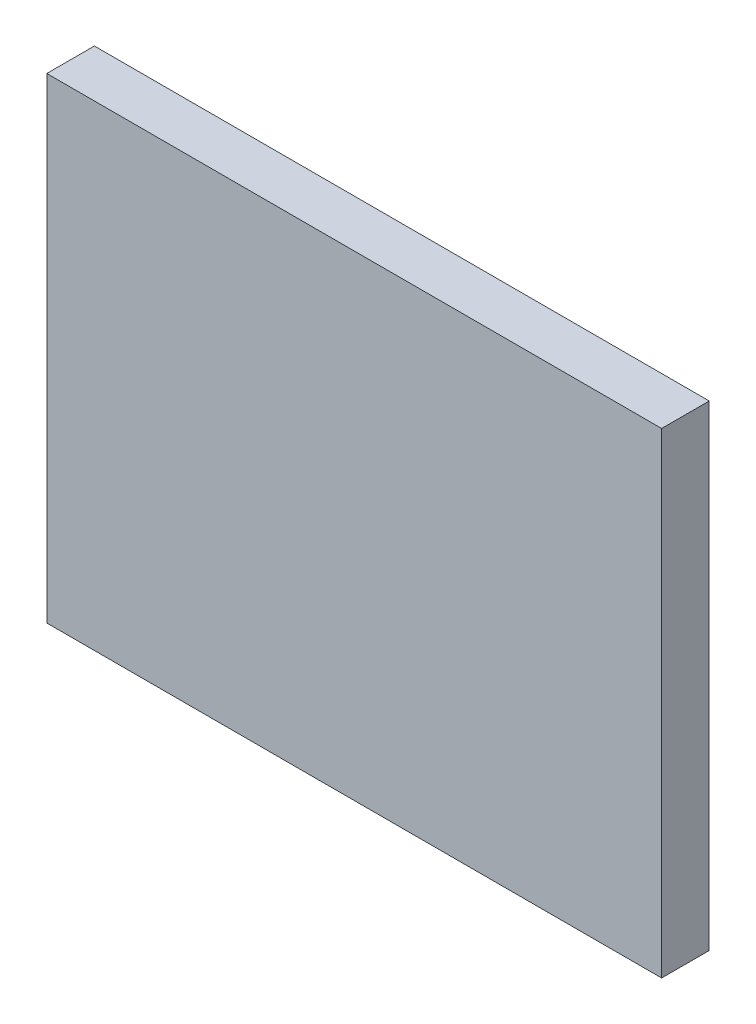
from build123d import *

# Parameters (mm, degrees)
ESQUISSE1_W        = 64.594588492
ESQUISSE1_H        = 50
BOSS_EXTRU_1_DEPTH = 5


with BuildPart() as part:
    # Esquisse1 → Boss.-Extru.1 (new body)
    with BuildSketch(Plane.XY):
        Rectangle(ESQUISSE1_W, ESQUISSE1_H)
    extrude(amount=BOSS_EXTRU_1_DEPTH)


solid = part.part
